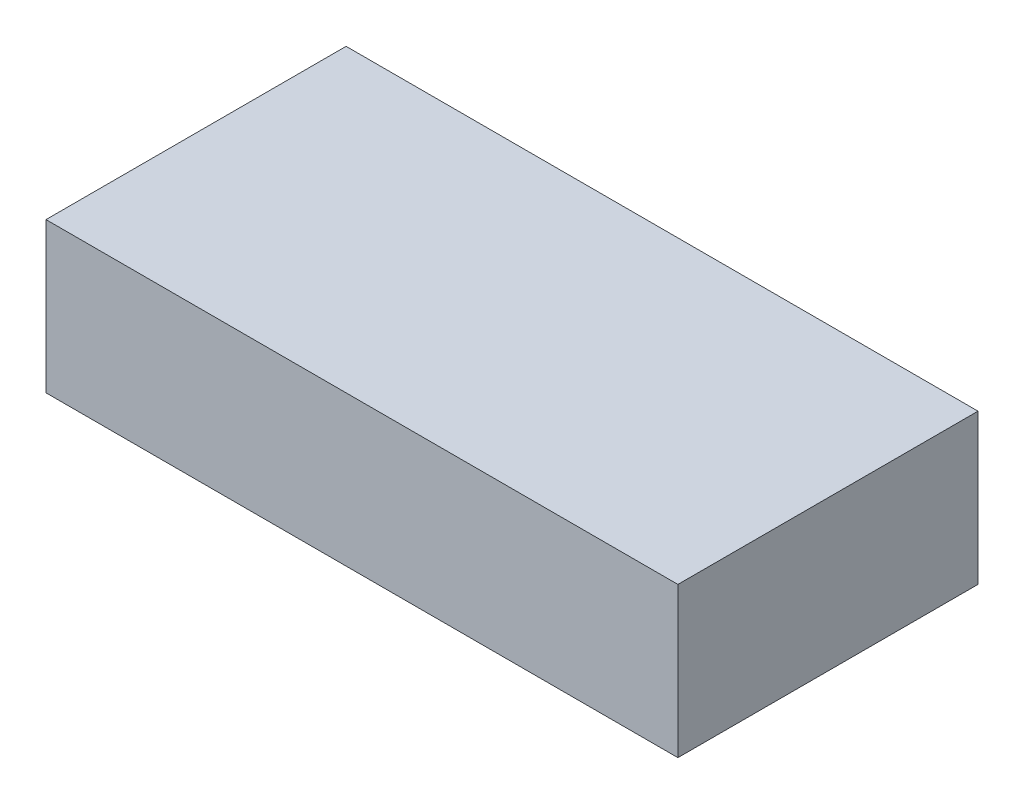
from build123d import *

# Parameters (mm, degrees)
SKETCH1_W           = 75.946
SKETCH1_H           = 36.068
BOSS_EXTRUDE1_DEPTH = 18.034
SKETCH2_R           = 2.54
BOSS_EXTRUDE2_DEPTH = 2.54


with BuildPart() as part:
    # Sketch1 → Boss-Extrude1 (new body)
    with BuildSketch(Plane(origin=(0, 0, 0), x_dir=(1, 0, 0), z_dir=(0, 1, 0))):
        Rectangle(SKETCH1_W, SKETCH1_H)
    extrude(amount=BOSS_EXTRUDE1_DEPTH)

    # Sketch2 → Boss-Extrude2 (add)
    with BuildSketch(Plane.ZY.offset(37.973)):
        with Locations((-3.556, 8.509)):
            Circle(SKETCH2_R)
        with Locations(Location((3.556, 8.509, 0), (0, 0, 180))):
            Circle(SKETCH2_R)
    extrude(amount=BOSS_EXTRUDE2_DEPTH)


solid = part.part
